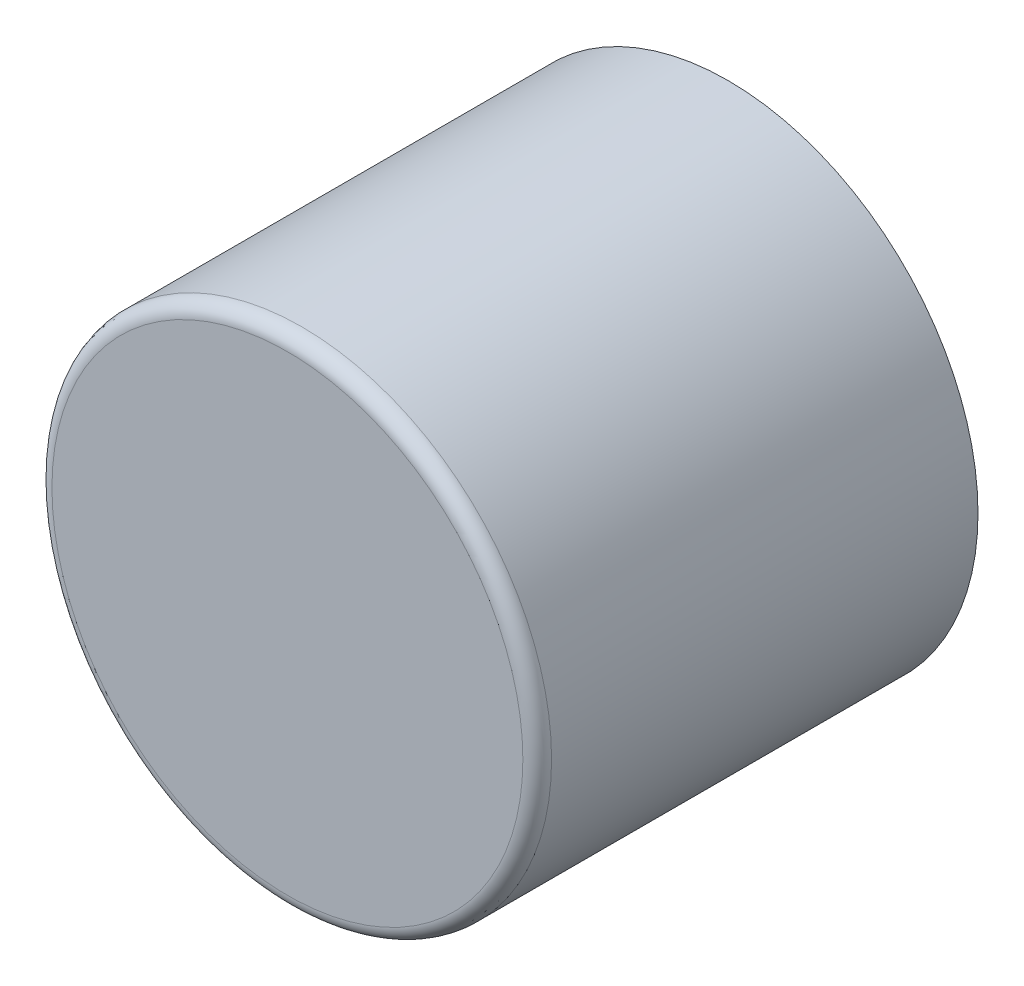
from build123d import *

# Parameters (mm, degrees)
CROQUIS1_R              = 17.4
SALIENTE_EXTRUIR1_DEPTH = 30.7
REDONDEO1_R             = 1


with BuildPart() as part:
    # Croquis1 → Saliente-Extruir1 (new body)
    with BuildSketch(Plane.XY):
        Circle(CROQUIS1_R)
    extrude(amount=SALIENTE_EXTRUIR1_DEPTH)

    # Redondeo1
    redondeo1_edges = [part.edges().sort_by_distance(p)[0] for p in [
        (-17.4, 0, 30.7),
    ]]
    fillet(redondeo1_edges, radius=REDONDEO1_R)


solid = part.part
